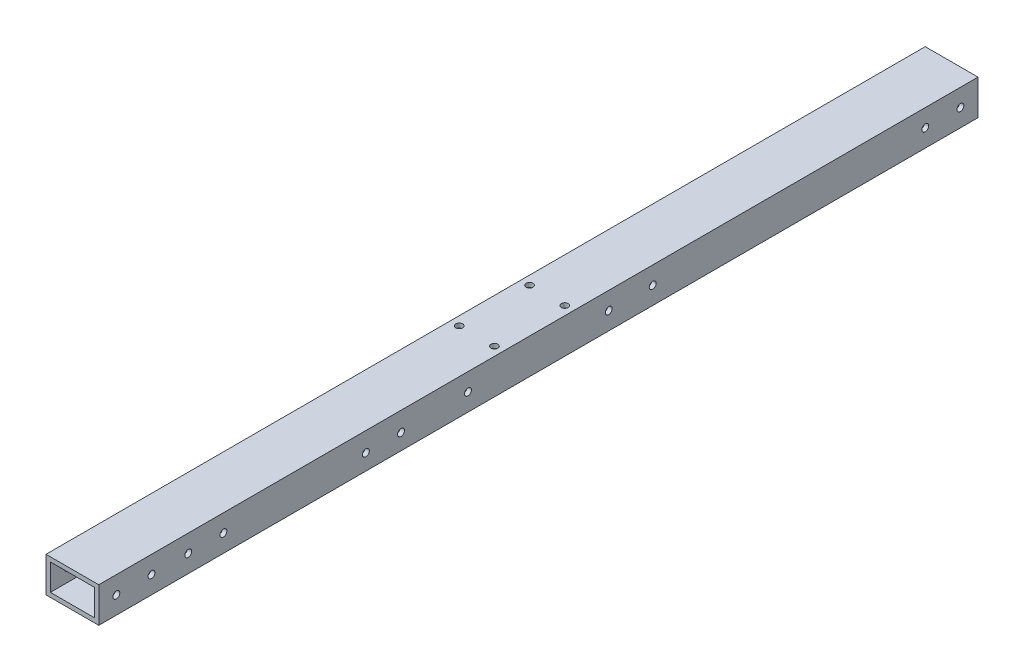
from build123d import *

# Parameters (mm, degrees)
BOSS_EXTRUDE1_DEPTH             = 317.499999
BOSS_EXTRUDE1_DEPTH_BACK        = 317.499999
SKETCH3_W                       = 38.1
SKETCH3_H                       = 25.4
SKETCH3_W_2                     = 31.75
SKETCH3_H_2                     = 19.05
F_10_CLEARANCE_HOLE2_D          = 4.9784
F_10_CLEARANCE_HOLE5_D          = 4.9784
F_10_CLEARANCE_HOLE4_D          = 4.9784
F_10_CLEARANCE_HOLE3_D          = 4.9784
F_10_CLEARANCE_HOLE6_AT_2_COUNT = 2
F_10_CLEARANCE_HOLE6_AT_2_PITCH = 25.4
F_10_CLEARANCE_HOLE6_AT_3_COUNT = 2
F_10_CLEARANCE_HOLE6_AT_3_PITCH = 50.8
F_10_CLEARANCE_HOLE6_AT_4_COUNT = 2
F_10_CLEARANCE_HOLE6_AT_4_PITCH = 56.796126628
F_10_CLEARANCE_HOLE7_D          = 4.9784


with BuildPart() as part:
    # Sketch3 → Boss-Extrude1 (new, two sides: drawn at the far end of the back side and taken through both)
    with BuildSketch(Plane.XY.offset(-BOSS_EXTRUDE1_DEPTH_BACK)):
        Rectangle(SKETCH3_W, SKETCH3_H)
        Rectangle(SKETCH3_W_2, SKETCH3_H_2, mode=Mode.SUBTRACT)
    extrude(amount=BOSS_EXTRUDE1_DEPTH + BOSS_EXTRUDE1_DEPTH_BACK)

    # #10 Clearance Hole2 (through all)
    with Locations(Plane.ZY.offset(19.05)):
        with Locations((-304.799999492, 0), (-279.399999492, 0), (279.400000508, 0), (304.800000508, 0)):
            Hole(F_10_CLEARANCE_HOLE2_D / 2)

    # #10 Clearance Hole5 (through all)
    with Locations(Plane(origin=(19.05, 0, 0), x_dir=(0, 0, -1), z_dir=(1, 0, 0))):
        with Locations((-124.587000508, -1.231595708), (-99.187000508, -1.231595708), (-252.857000508, -5.03e-07), (-227.457000508, -5.03e-07)):
            Hole(F_10_CLEARANCE_HOLE5_D / 2)

    # #10 Clearance Hole4 (through all)
    with Locations(Plane(origin=(19.05, 0, 0), x_dir=(0, 0, -1), z_dir=(1, 0, 0))):
        with Locations((-252.857000508, -5.03e-07), (-227.457000508, -5.03e-07)):
            Hole(F_10_CLEARANCE_HOLE4_D / 2)

    # #10 Clearance Hole3 (through all)
    with Locations(Plane.ZY.offset(19.05)):
        with Locations((-50.8, 0), (50.8, 0)):
            Hole(F_10_CLEARANCE_HOLE3_D / 2)

    # Sketch26 → #10 Clearance Hole6 (revolve, cut)
    with BuildSketch(Plane(origin=(12.7, 12.7, 25.4), x_dir=(0, 0, 1), z_dir=(1, 0, 0))):
        Polygon((0, 0), (0, 25.4), (5.2197, 25.4), (2.4892, 22.258919064), (2.4892, 0), align=None)
    f_10_clearance_hole6 = revolve(axis=Axis((12.7, 19.05, 25.4), (0, -1, 0)), mode=Mode.SUBTRACT)

    # #10 Clearance Hole6 at 2: #10 Clearance Hole6 ×2
    with Locations(*[(-i * F_10_CLEARANCE_HOLE6_AT_2_PITCH, 0, 0) for i in range(1, F_10_CLEARANCE_HOLE6_AT_2_COUNT)]):
        add(f_10_clearance_hole6, mode=Mode.SUBTRACT)

    # #10 Clearance Hole6 at 3: #10 Clearance Hole6 ×2
    with Locations(*[(0, 0, -i * F_10_CLEARANCE_HOLE6_AT_3_PITCH) for i in range(1, F_10_CLEARANCE_HOLE6_AT_3_COUNT)]):
        add(f_10_clearance_hole6, mode=Mode.SUBTRACT)

    # #10 Clearance Hole6 at 4: #10 Clearance Hole6 ×2
    with Locations(*[Vector(-0.447213595499958, 0, -0.894427190999916) * (i * F_10_CLEARANCE_HOLE6_AT_4_PITCH) for i in range(1, F_10_CLEARANCE_HOLE6_AT_4_COUNT)]):
        add(f_10_clearance_hole6, mode=Mode.SUBTRACT)

    # #10 Clearance Hole7 (through all)
    with Locations(Plane.ZY.offset(19.05)):
        with Locations((-82.55, 0)):
            Hole(F_10_CLEARANCE_HOLE7_D / 2)


solid = part.part
